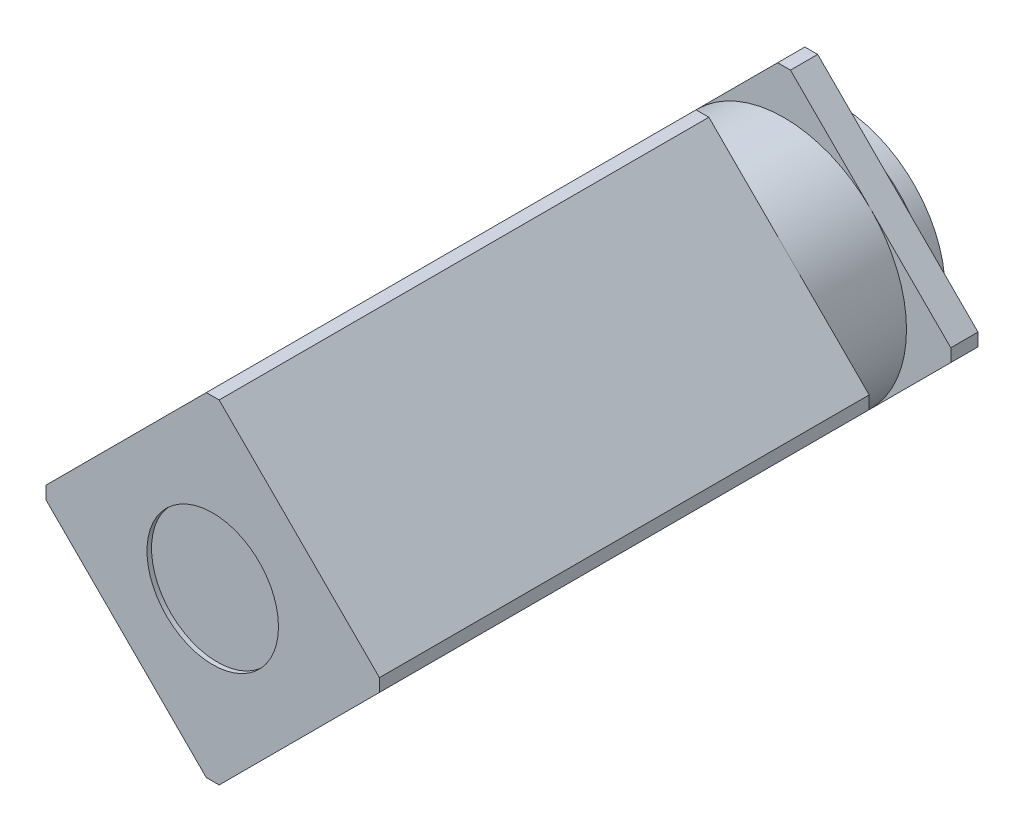
from build123d import *

# Parameters (mm, degrees)
EXTRUDE_1_DEPTH     = 108
SKETCH_2_R          = 27
EXTRUDE_2_DEPTH     = 18
EXTRUDE_3_DEPTH     = 6
SKETCH_4_R          = 24.5
EXTRUDE_4_DEPTH     = 2
SKETCH_5_R          = 23.5
EXTRUDE_5_DEPTH     = 4
SKETCH_7_R          = 1.6
SKETCH_7_R_2        = 1.45
SKETCH_7_R_3        = 1.464509856
CUT_EXTRUDE_1_DEPTH = 14
SKETCH_8_R          = 14.5
CUT_EXTRUDE_2_DEPTH = 1


with BuildPart() as part:
    # 스케치1 → 보스-돌출1 (new body)
    with BuildSketch(Plane.XY):
        Polygon((-6.769552622, 334.414213562), (-6.769552622, 331.585786438), (28.585786438, 296.230447378), (31.414213562, 296.230447378), (66.769552622, 331.585786438), (66.769552622, 334.414213562), (31.414213562, 369.769552622), (28.585786438, 369.769552622), align=None)
    extrude(amount=-EXTRUDE_1_DEPTH)

    # 스케치2 → 보스-돌출2 (add)
    with BuildSketch(Plane(origin=(0, 0, -108), x_dir=(-1, 0, 0), z_dir=(0, 0, -1))):
        with Locations(Location((-30, 333, 0), (0, 0, 135))):
            Circle(SKETCH_2_R)
    extrude(amount=EXTRUDE_2_DEPTH)

    # 스케치3 → 보스-돌출3 (add)
    with BuildSketch(Plane(origin=(0, 0, -126), x_dir=(-1, 0, 0), z_dir=(0, 0, -1))):
        Polygon((6.769552622, 331.585786438), (6.769552622, 334.414213562), (-28.585786438, 369.769552622), (-31.414213562, 369.769552622), (-66.769552622, 334.414213562), (-66.769552622, 331.585786438), (-31.414213562, 296.230447378), (-28.585786438, 296.230447378), align=None)
    extrude(amount=EXTRUDE_3_DEPTH)

    # 스케치4 → 보스-돌출4 (add)
    with BuildSketch(Plane(origin=(0, 0, -132), x_dir=(-1, 0, 0), z_dir=(0, 0, -1))):
        with Locations((-30, 333)):
            Circle(SKETCH_4_R)
    extrude(amount=EXTRUDE_4_DEPTH)

    # 스케치5 → 보스-돌출5 (add)
    with BuildSketch(Plane(origin=(0, 0, -134), x_dir=(-1, 0, 0), z_dir=(0, 0, -1))):
        with Locations((-30, 333)):
            Circle(SKETCH_5_R)
    extrude(amount=EXTRUDE_5_DEPTH)

    # 스케치7 → 컷-돌출1 (cut)
    with BuildSketch(Plane(origin=(-132.408116908, 132.408116908, 0), x_dir=(0, 0, -1), z_dir=(0.7071067811863883, -0.7071067811867069, 0))):
        with Locations(Location((105, 274.679761571, 0), (0, 0, 90))):
            Circle(SKETCH_7_R)
        with Locations(Location((93, 274.679761571, 0), (0, 0, 90))):
            Circle(SKETCH_7_R_2)
        with Locations(Location((81, 274.679761571, 0), (0, 0, 90))):
            Circle(SKETCH_7_R_2)
        with Locations(Location((69, 274.679761571, 0), (0, 0, 90))):
            Circle(SKETCH_7_R_2)
        with Locations(Location((57, 274.679761571, 0), (0, 0, 90))):
            Circle(SKETCH_7_R_2)
        with Locations(Location((45, 274.679761571, 0), (0, 0, 90))):
            Circle(SKETCH_7_R_2)
        with Locations(Location((33, 274.679761571, 0), (0, 0, 90))):
            Circle(SKETCH_7_R_2)
        with Locations(Location((21, 274.679761571, 0), (0, 0, 90))):
            Circle(SKETCH_7_R_3)
        with Locations(Location((21, 238.679761571, 0), (0, 0, 90))):
            Circle(SKETCH_7_R_2)
        with Locations(Location((33, 238.679761571, 0), (0, 0, 90))):
            Circle(SKETCH_7_R_2)
        with Locations(Location((45, 238.679761571, 0), (0, 0, 90))):
            Circle(SKETCH_7_R_2)
        with Locations(Location((57, 238.679761571, 0), (0, 0, 90))):
            Circle(SKETCH_7_R_2)
        with Locations(Location((69, 238.679761571, 0), (0, 0, 90))):
            Circle(SKETCH_7_R_2)
        with Locations(Location((81, 238.679761571, 0), (0, 0, 90))):
            Circle(SKETCH_7_R_2)
        with Locations(Location((93, 238.679761571, 0), (0, 0, 90))):
            Circle(SKETCH_7_R_2)
        with Locations(Location((105, 238.679761571, 0), (0, 0, 90))):
            Circle(SKETCH_7_R)
    extrude(amount=-CUT_EXTRUDE_1_DEPTH, mode=Mode.SUBTRACT)

    # 스케치8 → 컷-돌출2 (cut)
    with BuildSketch(Plane.XY):
        with Locations((30, 333)):
            Circle(SKETCH_8_R)
    extrude(amount=-CUT_EXTRUDE_2_DEPTH, mode=Mode.SUBTRACT)


solid = part.part
